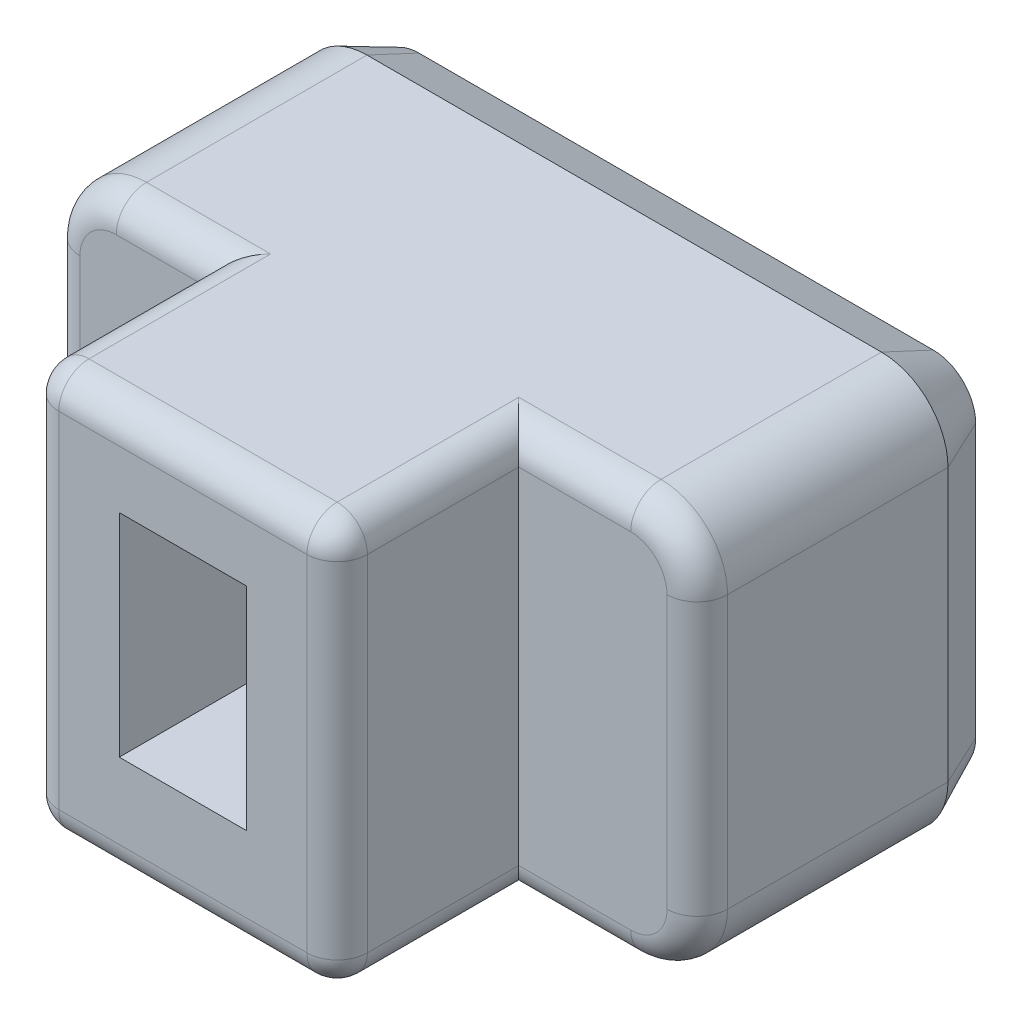
from build123d import *

# Parameters (mm, degrees)
BOSS_EXTRU_1_DEPTH      = 8
ESQUISSE3_W             = 2.1
ESQUISSE3_H             = 3.5
ENL_V_MAT_EXTRU_1_DEPTH = 3
ESQUISSE4_OUTSIDE_W     = 15.69
ESQUISSE4_OUTSIDE_H     = 11.69
ESQUISSE4_OUTSIDE_W_2   = 5.1
ESQUISSE4_OUTSIDE_H_2   = 6.7
ENL_V_MAT_EXTRU_2_DEPTH = 3
CONG_1_R                = 0.5
CHANFREIN1_SIZE         = 0.4
CHANFREIN1_SIZE2        = 0.857802768
ENL_V_MAT_EXTRU_3_DEPTH = 0.3
BOSS_EXTRU_2_START      = -0.2
BOSS_EXTRU_2_DEPTH      = 0.2
BOSS_EXTRU_2_2_DEPTH    = 0.2
BOSS_EXTRU_2_3_DEPTH    = 0.2


with BuildPart() as part:
    # Esquisse2 → Boss.-Extru.1 (new body)
    with BuildSketch(Plane.XY):
        with BuildLine():
            Line((1.1, 0), (9.6, 0))
            ThreePointArc((9.6, 0), (10.377817459, 0.322182541), (10.7, 1.1))
            Line((10.7, 1.1), (10.7, 5.6))
            ThreePointArc((10.7, 5.6), (10.377817459, 6.377817459), (9.6, 6.7))
            Line((9.6, 6.7), (1.1, 6.7))
            ThreePointArc((1.1, 6.7), (0.322182541, 6.377817459), (0, 5.6))
            Line((0, 5.6), (0, 1.1))
            ThreePointArc((0, 1.1), (0.322182541, 0.322182541), (1.1, 0))
        make_face()
    extrude(amount=BOSS_EXTRU_1_DEPTH)

    # Esquisse3 → Enlèv. mat.-Extru.1 (cut)
    with BuildSketch(Plane.XY.offset(8)):
        with Locations((5.2, 3.5)):
            Rectangle(ESQUISSE3_W, ESQUISSE3_H)
    extrude(amount=-ENL_V_MAT_EXTRU_1_DEPTH, mode=Mode.SUBTRACT)

    # Esquisse4 outside → Enlèv. mat.-Extru.2 (cut)
    with BuildSketch(Plane.XY.offset(8)):
        with Locations((5.35, 3.35)):
            Rectangle(ESQUISSE4_OUTSIDE_W, ESQUISSE4_OUTSIDE_H)
        with Locations((5.2, 3.35)):
            Rectangle(ESQUISSE4_OUTSIDE_W_2, ESQUISSE4_OUTSIDE_H_2, mode=Mode.SUBTRACT)
    extrude(amount=-ENL_V_MAT_EXTRU_2_DEPTH, mode=Mode.SUBTRACT)

    # Congé1
    cong_1_edges = [part.edges().sort_by_distance(p)[0] for p in [
        (8.675, 0, 5),
        (10.377817459, 0.322182541, 5),
        (10.7, 3.35, 5),
        (10.377817459, 6.377817459, 5),
        (1.875, 6.7, 5),
        (0.322182541, 6.377817459, 5),
        (1.875, 0, 5),
        (0.322182541, 0.322182541, 5),
        (7.75, 6.7, 6.5),
        (2.65, 6.7, 6.5),
        (7.75, 0, 6.5),
        (2.65, 0, 6.5),
        (2.65, 3.35, 8),
        (5.2, 6.7, 8),
        (7.75, 3.35, 8),
        (5.2, 0, 8),
        (8.675, 6.7, 5),
        (0, 3.35, 5),
    ]]
    fillet(cong_1_edges, radius=CONG_1_R)

    # Chanfrein1
    chanfrein1_edges = [part.edges().sort_by_distance(p)[0] for p in [
        (5.35, 0, 0),
        (10.377817459, 0.322182541, 0),
        (0.322182541, 0.322182541, 0),
        (10.7, 3.35, 0),
        (0, 3.35, 0),
        (10.377817459, 6.377817459, 0),
        (0.322182541, 6.377817459, 0),
        (5.35, 6.7, 0),
    ]]
    chanfrein1_side = [part.faces().sort_by_distance(p)[0] for p in [
        (5.35, 3.35, 0),
    ]]
    chamfer(chanfrein1_edges, length=CHANFREIN1_SIZE, length2=CHANFREIN1_SIZE2, reference=chanfrein1_side[0])

    # Esquisse5 → Enlèv. mat.-Extru.3 (cut)
    # profile 1 of 3: a face of its own
    with BuildSketch(Plane.XY.offset(0.2)):
        Polygon((2.715926417, 1.356639893), (4.049259751, 5.356639893), (3.714323853, 5.356639893), (3.28724052, 4.074588611), (2.093330264, 4.074588611), (1.66624693, 5.356639893), (1.331311033, 5.356639893), (2.664644366, 1.356639893), align=None)
        Polygon((2.690285392, 2.284524508), (2.230349494, 3.6643322), (3.150221289, 3.6643322), align=None, mode=Mode.SUBTRACT)
    # profile 2 of 3: a face of its own
    with BuildSketch(Plane.XY.offset(0.2)):
        with BuildLine():
            Line((4.715926417, 1.356639893), (5.336920007, 1.356639893))
            add(Edge.make_bspline(
                [(5.336920007, 1.356639893), (5.379658103, 1.356696636), (5.461408584, 1.356805175), (5.578672447, 1.360274287), (5.685010084, 1.364829513), (5.780641294, 1.37131342), (5.865472388, 1.378686813), (5.939417023, 1.389474867), (6.002893824, 1.400386425), (6.04078812, 1.411614353), (6.058073853, 1.416736047)],
                knots=[0, 0, 0, 0, 1.41329272, 2.703381044, 3.879352496, 4.932840985, 5.873286362, 6.69398654, 7.404253327, 8, 8, 8, 8], degree=3))
            add(Edge.make_bspline(
                [(6.058073853, 1.416736047), (6.080161933, 1.424286398), (6.123860694, 1.439223913), (6.186059247, 1.469742784), (6.245528717, 1.504773951), (6.301851746, 1.546170424), (6.355388277, 1.592314499), (6.405695827, 1.644425317), (6.4527659, 1.702099596), (6.496797869, 1.765095768), (6.536168906, 1.833486184), (6.570128529, 1.90632743), (6.600631829, 1.982749499), (6.623293653, 2.064313431), (6.641586034, 2.149696923), (6.655417136, 2.239282449), (6.663480934, 2.332984484), (6.66425161, 2.396955332), (6.664644366, 2.429556559)],
                knots=[0, 0, 0, 0, 0.884482799, 1.749848896, 2.621947624, 3.499266614, 4.396934619, 5.299561366, 6.242497396, 7.217586033, 8.211436111, 9.230972356, 10.263708326, 11.328149876, 12.436788748, 13.574299448, 14.763799138, 16, 16, 16, 16], degree=3))
            add(Edge.make_bspline(
                [(6.664644366, 2.429556559), (6.664290673, 2.462429803), (6.663599415, 2.526677392), (6.655040801, 2.620804797), (6.642814036, 2.710586622), (6.624028261, 2.795879568), (6.60103623, 2.876811166), (6.572913837, 2.953535426), (6.539445591, 3.025825184), (6.499892499, 3.092982229), (6.456604208, 3.155735172), (6.409427108, 3.213609836), (6.357926364, 3.265913677), (6.302467958, 3.312722651), (6.242762209, 3.353343116), (6.179978258, 3.390133534), (6.112577177, 3.420288462), (6.065679184, 3.436574637), (6.042048212, 3.444780918)],
                knots=[0, 0, 0, 0, 1.230348438, 2.404597596, 3.535952481, 4.620603023, 5.671397407, 6.683805958, 7.676968664, 8.649426021, 9.598095933, 10.528942615, 11.441124898, 12.342499997, 13.24120863, 14.141695784, 15.06363722, 16, 16, 16, 16], degree=3))
            add(Edge.make_bspline(
                [(6.042048212, 3.444780918), (6.022339918, 3.450092946), (5.979511345, 3.461636643), (5.908823474, 3.474893412), (5.826666462, 3.485649394), (5.73320292, 3.495680545), (5.627803443, 3.501034621), (5.511126875, 3.507233793), (5.382875076, 3.510202155), (5.293651547, 3.510388817), (5.247176417, 3.510486047)],
                knots=[0, 0, 0, 0, 0.612388924, 1.330797261, 2.156047033, 3.098784286, 4.150775458, 5.322387776, 6.605273988, 8, 8, 8, 8], degree=3))
            Line((5.247176417, 3.510486047), (5.023618725, 3.510486047))
            Line((5.023618725, 3.510486047), (5.023618725, 5.356639893))
            Line((5.023618725, 5.356639893), (4.715926417, 5.356639893))
            Line((4.715926417, 5.356639893), (4.715926417, 1.356639893))
        make_face()
        with BuildLine():
            Line((5.023618725, 1.766896303), (5.023618725, 3.100229636))
            Line((5.023618725, 3.100229636), (5.558875135, 3.109043739))
            add(Edge.make_bspline(
                [(5.558875135, 3.109043739), (5.58505921, 3.109067086), (5.635592476, 3.109112145), (5.708768449, 3.104468801), (5.776457827, 3.099447953), (5.838743122, 3.091273821), (5.895556357, 3.081253356), (5.946991259, 3.067971645), (5.993630479, 3.054571169), (6.047016398, 3.030404811), (6.107174467, 2.994993623), (6.171374474, 2.9407707), (6.226320092, 2.874412807), (6.273381616, 2.798340229), (6.311105934, 2.714318731), (6.337049093, 2.624149394), (6.353804151, 2.52926651), (6.355887034, 2.464351584), (6.356952058, 2.431159123)],
                knots=[0, 0, 0, 0, 1.041889711, 2.010767563, 2.917459415, 3.742918794, 4.510266019, 5.211588092, 5.857195523, 6.437923133, 7.53914018, 8.625373984, 9.764675209, 10.953539484, 12.176517443, 13.417794654, 14.679660394, 16, 16, 16, 16], degree=3))
            add(Edge.make_bspline(
                [(6.356952058, 2.431159123), (6.355838313, 2.399039931), (6.353633917, 2.335467551), (6.337193315, 2.24239174), (6.310829583, 2.153138152), (6.27324056, 2.06985344), (6.22767662, 1.993874149), (6.173334102, 1.928969097), (6.112816446, 1.875419123), (6.056103113, 1.839514239), (6.004878723, 1.819002388), (5.961295839, 1.803866365), (5.911626033, 1.793639145), (5.856627394, 1.783751954), (5.79620738, 1.775858998), (5.729905109, 1.770318786), (5.658265892, 1.767153092), (5.608557807, 1.766983694), (5.582913597, 1.766896303)],
                knots=[0, 0, 0, 0, 1.310700347, 2.594222759, 3.846471066, 5.100853847, 6.314529516, 7.452362497, 8.541722804, 9.60395051, 10.170956782, 10.791621451, 11.48468842, 12.237615023, 13.073459376, 13.970836629, 14.953162401, 16, 16, 16, 16], degree=3))
            Line((5.582913597, 1.766896303), (5.023618725, 1.766896303))
        make_face(mode=Mode.SUBTRACT)
    # profile 3 of 3: a face of its own
    with BuildSketch(Plane.XY.offset(0.2)):
        with BuildLine():
            Line((7.280028981, 1.356639893), (7.901022571, 1.356639893))
            add(Edge.make_bspline(
                [(7.901022571, 1.356639893), (7.942421803, 1.356813621), (8.021755746, 1.357146539), (8.13585327, 1.359104556), (8.239449968, 1.364479114), (8.332790263, 1.369222879), (8.415260527, 1.377804995), (8.487573776, 1.385906574), (8.54944043, 1.396817021), (8.586703386, 1.406636008), (8.60374693, 1.411127072)],
                knots=[0, 0, 0, 0, 1.406291012, 2.694895705, 3.875596585, 4.929939196, 5.86881668, 6.691431991, 7.401479668, 8, 8, 8, 8], degree=3))
            add(Edge.make_bspline(
                [(8.60374693, 1.411127072), (8.626348359, 1.418428314), (8.671598389, 1.433046038), (8.736210516, 1.46286216), (8.797595388, 1.498696692), (8.856421005, 1.539177196), (8.910914398, 1.587041789), (8.962311423, 1.640360733), (9.011343323, 1.69860091), (9.056203816, 1.763055522), (9.096690403, 1.832154913), (9.132286828, 1.9054881), (9.161825317, 1.983084396), (9.18674628, 2.064083165), (9.205033851, 2.149419581), (9.218391485, 2.238264035), (9.227850333, 2.331064541), (9.228445117, 2.394275862), (9.22874693, 2.426351431)],
                knots=[0, 0, 0, 0, 0.890159445, 1.782176851, 2.661847792, 3.553865198, 4.455671456, 5.376579952, 6.329510008, 7.307692435, 8.31786882, 9.330376746, 10.36095783, 11.428835377, 12.505555716, 13.63040485, 14.79758702, 16, 16, 16, 16], degree=3))
            add(Edge.make_bspline(
                [(9.22874693, 2.426351431), (9.227507374, 2.479585552), (9.225097381, 2.583085428), (9.202218208, 2.733381187), (9.164497091, 2.873658567), (9.112972652, 3.003826255), (9.046558386, 3.121306556), (8.966601235, 3.224172472), (8.874065718, 3.31220369), (8.785990447, 3.372432668), (8.708089424, 3.411355683), (8.644719041, 3.438398436), (8.575191109, 3.459383296), (8.500917514, 3.477967155), (8.421139545, 3.492294901), (8.336330461, 3.502502476), (8.246208795, 3.509042475), (8.184420897, 3.509995582), (8.152625135, 3.510486047)],
                knots=[0, 0, 0, 0, 1.4629789, 2.844381281, 4.168060411, 5.450008344, 6.683409462, 7.866022178, 9.019310308, 10.182424534, 10.783479041, 11.412251156, 12.074243506, 12.777826466, 13.516816875, 14.301129003, 15.125768982, 16, 16, 16, 16], degree=3))
            Line((8.152625135, 3.510486047), (9.280028981, 5.356639893))
            Line((9.280028981, 5.356639893), (8.888202058, 5.356639893))
            Line((8.888202058, 5.356639893), (7.760798212, 3.510486047))
            Line((7.760798212, 3.510486047), (7.587721289, 3.510486047))
            Line((7.587721289, 3.510486047), (7.587721289, 5.356639893))
            Line((7.587721289, 5.356639893), (7.280028981, 5.356639893))
            Line((7.280028981, 5.356639893), (7.280028981, 1.356639893))
        make_face()
        with BuildLine():
            Line((7.587721289, 1.766896303), (7.587721289, 3.100229636))
            Line((7.587721289, 3.100229636), (8.131791802, 3.105838611))
            add(Edge.make_bspline(
                [(8.131791802, 3.105838611), (8.181243372, 3.105003235), (8.273150697, 3.103450663), (8.401119194, 3.090161011), (8.50894315, 3.068473752), (8.59818295, 3.034902158), (8.672708416, 2.990811383), (8.736191612, 2.935370529), (8.792662136, 2.869723746), (8.838017413, 2.792739243), (8.875107882, 2.708571743), (8.901187347, 2.618549669), (8.917897244, 2.523655081), (8.919986394, 2.458741779), (8.921054623, 2.425550149)],
                knots=[0, 0, 0, 0, 1.484367149, 2.7587438, 3.858219379, 4.777130865, 5.607825064, 6.443728638, 7.29703089, 8.19649044, 9.115786766, 10.05213422, 11.004012465, 12, 12, 12, 12], degree=3))
            add(Edge.make_bspline(
                [(8.921054623, 2.425550149), (8.91995352, 2.393429835), (8.917783172, 2.330118533), (8.901306087, 2.237566534), (8.874887649, 2.149136382), (8.83756915, 2.066752424), (8.791540405, 1.992094465), (8.737471515, 1.928385397), (8.677445372, 1.875124486), (8.621123518, 1.839875137), (8.570187262, 1.818640345), (8.52639651, 1.804070943), (8.476294906, 1.793498225), (8.420975419, 1.783863762), (8.360052084, 1.775783408), (8.293468409, 1.770367626), (8.221034433, 1.767120369), (8.170791212, 1.766973058), (8.144612315, 1.766896303)],
                knots=[0, 0, 0, 0, 1.313137682, 2.588282835, 3.832400214, 5.079152676, 6.276491617, 7.408087164, 8.484055822, 9.548258813, 10.106251373, 10.738443295, 11.432799069, 12.197886161, 13.035284822, 13.945215938, 14.92936841, 16, 16, 16, 16], degree=3))
            Line((8.144612315, 1.766896303), (7.587721289, 1.766896303))
        make_face(mode=Mode.SUBTRACT)
    extrude(amount=-ENL_V_MAT_EXTRU_3_DEPTH, mode=Mode.SUBTRACT)


with BuildPart() as body_2:
    # Esquisse5<3> → Boss.-Extru.2 (new body)
    with BuildSketch(Plane.XY.offset(0.2).offset(BOSS_EXTRU_2_START)):
        Polygon((2.715926417, 1.356639893), (4.049259751, 5.356639893), (3.714323853, 5.356639893), (3.28724052, 4.074588611), (2.093330264, 4.074588611), (1.66624693, 5.356639893), (1.331311033, 5.356639893), (2.664644366, 1.356639893), align=None)
        Polygon((2.690285392, 2.284524508), (2.230349494, 3.6643322), (3.150221289, 3.6643322), align=None, mode=Mode.SUBTRACT)
    extrude(amount=-BOSS_EXTRU_2_DEPTH)


with BuildPart() as body_3:
    # Esquisse5<3> → Boss.-Extru.2 2 (new body)
    with BuildSketch(Plane.XY.offset(0.2).offset(BOSS_EXTRU_2_START)):
        with BuildLine():
            Line((4.715926417, 1.356639893), (5.336920007, 1.356639893))
            add(Edge.make_bspline(
                [(5.336920007, 1.356639893), (5.379658103, 1.356696636), (5.461408584, 1.356805175), (5.578672447, 1.360274287), (5.685010084, 1.364829513), (5.780641294, 1.37131342), (5.865472388, 1.378686813), (5.939417023, 1.389474867), (6.002893824, 1.400386425), (6.04078812, 1.411614353), (6.058073853, 1.416736047)],
                knots=[0, 0, 0, 0, 1.41329272, 2.703381044, 3.879352496, 4.932840985, 5.873286362, 6.69398654, 7.404253327, 8, 8, 8, 8], degree=3))
            add(Edge.make_bspline(
                [(6.058073853, 1.416736047), (6.080161933, 1.424286398), (6.123860694, 1.439223913), (6.186059247, 1.469742784), (6.245528717, 1.504773951), (6.301851746, 1.546170424), (6.355388277, 1.592314499), (6.405695827, 1.644425317), (6.4527659, 1.702099596), (6.496797869, 1.765095768), (6.536168906, 1.833486184), (6.570128529, 1.90632743), (6.600631829, 1.982749499), (6.623293653, 2.064313431), (6.641586034, 2.149696923), (6.655417136, 2.239282449), (6.663480934, 2.332984484), (6.66425161, 2.396955332), (6.664644366, 2.429556559)],
                knots=[0, 0, 0, 0, 0.884482799, 1.749848896, 2.621947624, 3.499266614, 4.396934619, 5.299561366, 6.242497396, 7.217586033, 8.211436111, 9.230972356, 10.263708326, 11.328149876, 12.436788748, 13.574299448, 14.763799138, 16, 16, 16, 16], degree=3))
            add(Edge.make_bspline(
                [(6.664644366, 2.429556559), (6.664290673, 2.462429803), (6.663599415, 2.526677392), (6.655040801, 2.620804797), (6.642814036, 2.710586622), (6.624028261, 2.795879568), (6.60103623, 2.876811166), (6.572913837, 2.953535426), (6.539445591, 3.025825184), (6.499892499, 3.092982229), (6.456604208, 3.155735172), (6.409427108, 3.213609836), (6.357926364, 3.265913677), (6.302467958, 3.312722651), (6.242762209, 3.353343116), (6.179978258, 3.390133534), (6.112577177, 3.420288462), (6.065679184, 3.436574637), (6.042048212, 3.444780918)],
                knots=[0, 0, 0, 0, 1.230348438, 2.404597596, 3.535952481, 4.620603023, 5.671397407, 6.683805958, 7.676968664, 8.649426021, 9.598095933, 10.528942615, 11.441124898, 12.342499997, 13.24120863, 14.141695784, 15.06363722, 16, 16, 16, 16], degree=3))
            add(Edge.make_bspline(
                [(6.042048212, 3.444780918), (6.022339918, 3.450092946), (5.979511345, 3.461636643), (5.908823474, 3.474893412), (5.826666462, 3.485649394), (5.73320292, 3.495680545), (5.627803443, 3.501034621), (5.511126875, 3.507233793), (5.382875076, 3.510202155), (5.293651547, 3.510388817), (5.247176417, 3.510486047)],
                knots=[0, 0, 0, 0, 0.612388924, 1.330797261, 2.156047033, 3.098784286, 4.150775458, 5.322387776, 6.605273988, 8, 8, 8, 8], degree=3))
            Line((5.247176417, 3.510486047), (5.023618725, 3.510486047))
            Line((5.023618725, 3.510486047), (5.023618725, 5.356639893))
            Line((5.023618725, 5.356639893), (4.715926417, 5.356639893))
            Line((4.715926417, 5.356639893), (4.715926417, 1.356639893))
        make_face()
        with BuildLine():
            Line((5.023618725, 1.766896303), (5.023618725, 3.100229636))
            Line((5.023618725, 3.100229636), (5.558875135, 3.109043739))
            add(Edge.make_bspline(
                [(5.558875135, 3.109043739), (5.58505921, 3.109067086), (5.635592476, 3.109112145), (5.708768449, 3.104468801), (5.776457827, 3.099447953), (5.838743122, 3.091273821), (5.895556357, 3.081253356), (5.946991259, 3.067971645), (5.993630479, 3.054571169), (6.047016398, 3.030404811), (6.107174467, 2.994993623), (6.171374474, 2.9407707), (6.226320092, 2.874412807), (6.273381616, 2.798340229), (6.311105934, 2.714318731), (6.337049093, 2.624149394), (6.353804151, 2.52926651), (6.355887034, 2.464351584), (6.356952058, 2.431159123)],
                knots=[0, 0, 0, 0, 1.041889711, 2.010767563, 2.917459415, 3.742918794, 4.510266019, 5.211588092, 5.857195523, 6.437923133, 7.53914018, 8.625373984, 9.764675209, 10.953539484, 12.176517443, 13.417794654, 14.679660394, 16, 16, 16, 16], degree=3))
            add(Edge.make_bspline(
                [(6.356952058, 2.431159123), (6.355838313, 2.399039931), (6.353633917, 2.335467551), (6.337193315, 2.24239174), (6.310829583, 2.153138152), (6.27324056, 2.06985344), (6.22767662, 1.993874149), (6.173334102, 1.928969097), (6.112816446, 1.875419123), (6.056103113, 1.839514239), (6.004878723, 1.819002388), (5.961295839, 1.803866365), (5.911626033, 1.793639145), (5.856627394, 1.783751954), (5.79620738, 1.775858998), (5.729905109, 1.770318786), (5.658265892, 1.767153092), (5.608557807, 1.766983694), (5.582913597, 1.766896303)],
                knots=[0, 0, 0, 0, 1.310700347, 2.594222759, 3.846471066, 5.100853847, 6.314529516, 7.452362497, 8.541722804, 9.60395051, 10.170956782, 10.791621451, 11.48468842, 12.237615023, 13.073459376, 13.970836629, 14.953162401, 16, 16, 16, 16], degree=3))
            Line((5.582913597, 1.766896303), (5.023618725, 1.766896303))
        make_face(mode=Mode.SUBTRACT)
    extrude(amount=-BOSS_EXTRU_2_2_DEPTH)


with BuildPart() as body_4:
    # Esquisse5<3> → Boss.-Extru.2 3 (new body)
    with BuildSketch(Plane.XY.offset(0.2).offset(BOSS_EXTRU_2_START)):
        with BuildLine():
            Line((7.280028981, 1.356639893), (7.901022571, 1.356639893))
            add(Edge.make_bspline(
                [(7.901022571, 1.356639893), (7.942421803, 1.356813621), (8.021755746, 1.357146539), (8.13585327, 1.359104556), (8.239449968, 1.364479114), (8.332790263, 1.369222879), (8.415260527, 1.377804995), (8.487573776, 1.385906574), (8.54944043, 1.396817021), (8.586703386, 1.406636008), (8.60374693, 1.411127072)],
                knots=[0, 0, 0, 0, 1.406291012, 2.694895705, 3.875596585, 4.929939196, 5.86881668, 6.691431991, 7.401479668, 8, 8, 8, 8], degree=3))
            add(Edge.make_bspline(
                [(8.60374693, 1.411127072), (8.626348359, 1.418428314), (8.671598389, 1.433046038), (8.736210516, 1.46286216), (8.797595388, 1.498696692), (8.856421005, 1.539177196), (8.910914398, 1.587041789), (8.962311423, 1.640360733), (9.011343323, 1.69860091), (9.056203816, 1.763055522), (9.096690403, 1.832154913), (9.132286828, 1.9054881), (9.161825317, 1.983084396), (9.18674628, 2.064083165), (9.205033851, 2.149419581), (9.218391485, 2.238264035), (9.227850333, 2.331064541), (9.228445117, 2.394275862), (9.22874693, 2.426351431)],
                knots=[0, 0, 0, 0, 0.890159445, 1.782176851, 2.661847792, 3.553865198, 4.455671456, 5.376579952, 6.329510008, 7.307692435, 8.31786882, 9.330376746, 10.36095783, 11.428835377, 12.505555716, 13.63040485, 14.79758702, 16, 16, 16, 16], degree=3))
            add(Edge.make_bspline(
                [(9.22874693, 2.426351431), (9.227507374, 2.479585552), (9.225097381, 2.583085428), (9.202218208, 2.733381187), (9.164497091, 2.873658567), (9.112972652, 3.003826255), (9.046558386, 3.121306556), (8.966601235, 3.224172472), (8.874065718, 3.31220369), (8.785990447, 3.372432668), (8.708089424, 3.411355683), (8.644719041, 3.438398436), (8.575191109, 3.459383296), (8.500917514, 3.477967155), (8.421139545, 3.492294901), (8.336330461, 3.502502476), (8.246208795, 3.509042475), (8.184420897, 3.509995582), (8.152625135, 3.510486047)],
                knots=[0, 0, 0, 0, 1.4629789, 2.844381281, 4.168060411, 5.450008344, 6.683409462, 7.866022178, 9.019310308, 10.182424534, 10.783479041, 11.412251156, 12.074243506, 12.777826466, 13.516816875, 14.301129003, 15.125768982, 16, 16, 16, 16], degree=3))
            Line((8.152625135, 3.510486047), (9.280028981, 5.356639893))
            Line((9.280028981, 5.356639893), (8.888202058, 5.356639893))
            Line((8.888202058, 5.356639893), (7.760798212, 3.510486047))
            Line((7.760798212, 3.510486047), (7.587721289, 3.510486047))
            Line((7.587721289, 3.510486047), (7.587721289, 5.356639893))
            Line((7.587721289, 5.356639893), (7.280028981, 5.356639893))
            Line((7.280028981, 5.356639893), (7.280028981, 1.356639893))
        make_face()
        with BuildLine():
            Line((7.587721289, 1.766896303), (7.587721289, 3.100229636))
            Line((7.587721289, 3.100229636), (8.131791802, 3.105838611))
            add(Edge.make_bspline(
                [(8.131791802, 3.105838611), (8.181243372, 3.105003235), (8.273150697, 3.103450663), (8.401119194, 3.090161011), (8.50894315, 3.068473752), (8.59818295, 3.034902158), (8.672708416, 2.990811383), (8.736191612, 2.935370529), (8.792662136, 2.869723746), (8.838017413, 2.792739243), (8.875107882, 2.708571743), (8.901187347, 2.618549669), (8.917897244, 2.523655081), (8.919986394, 2.458741779), (8.921054623, 2.425550149)],
                knots=[0, 0, 0, 0, 1.484367149, 2.7587438, 3.858219379, 4.777130865, 5.607825064, 6.443728638, 7.29703089, 8.19649044, 9.115786766, 10.05213422, 11.004012465, 12, 12, 12, 12], degree=3))
            add(Edge.make_bspline(
                [(8.921054623, 2.425550149), (8.91995352, 2.393429835), (8.917783172, 2.330118533), (8.901306087, 2.237566534), (8.874887649, 2.149136382), (8.83756915, 2.066752424), (8.791540405, 1.992094465), (8.737471515, 1.928385397), (8.677445372, 1.875124486), (8.621123518, 1.839875137), (8.570187262, 1.818640345), (8.52639651, 1.804070943), (8.476294906, 1.793498225), (8.420975419, 1.783863762), (8.360052084, 1.775783408), (8.293468409, 1.770367626), (8.221034433, 1.767120369), (8.170791212, 1.766973058), (8.144612315, 1.766896303)],
                knots=[0, 0, 0, 0, 1.313137682, 2.588282835, 3.832400214, 5.079152676, 6.276491617, 7.408087164, 8.484055822, 9.548258813, 10.106251373, 10.738443295, 11.432799069, 12.197886161, 13.035284822, 13.945215938, 14.92936841, 16, 16, 16, 16], degree=3))
            Line((8.144612315, 1.766896303), (7.587721289, 1.766896303))
        make_face(mode=Mode.SUBTRACT)
    extrude(amount=-BOSS_EXTRU_2_3_DEPTH)


solid = Compound([part.part, body_2.part, body_3.part, body_4.part])
